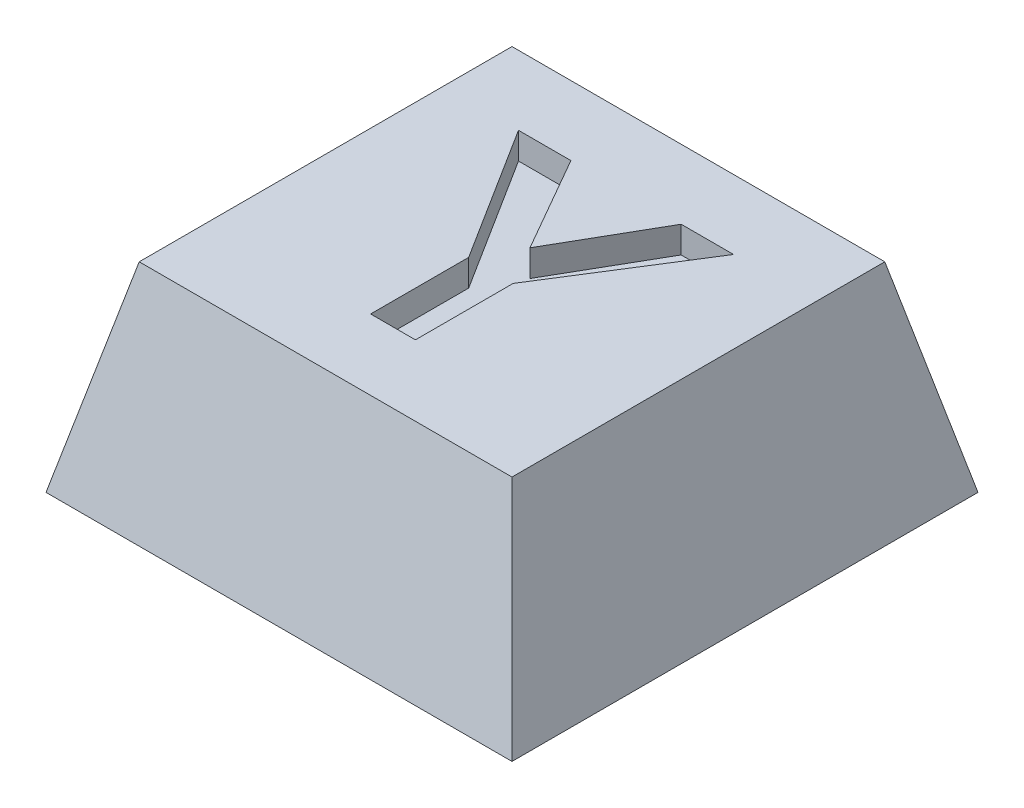
from build123d import *

# Parameters (mm, degrees)
SKETCH1_W           = 7
SKETCH1_H           = 7
BOSS_EXTRUDE1_DEPTH = 3
CUT_EXTRUDE1_DEPTH  = 7
CUT_EXTRUDE2_DEPTH  = 11
SKETCH4_R           = 1.8
CUT_EXTRUDE3_DEPTH  = 0.8
CUT_EXTRUDE4_DEPTH  = 0.4


with BuildPart() as part:
    # Sketch1 → Boss-Extrude1 (new body)
    with BuildSketch(Plane(origin=(0, 0, 0), x_dir=(1, 0, 0), z_dir=(0, 1, 0))):
        with Locations((3.5, 3.5)):
            Rectangle(SKETCH1_W, SKETCH1_H)
    extrude(amount=BOSS_EXTRUDE1_DEPTH)

    # Sketch2 → Cut-Extrude1 (cut)
    with BuildSketch(Plane.XY):
        Polygon((0, 0), (0.7, 3), (0, 3), align=None)
        Polygon((7, 0), (6.3, 3), (7, 3), align=None)
    extrude(amount=-CUT_EXTRUDE1_DEPTH, mode=Mode.SUBTRACT)

    # Sketch3 → Cut-Extrude2 (cut)
    with BuildSketch(Plane(origin=(0, 0, 0), x_dir=(0, 0, -1), z_dir=(1, 0, 0))):
        Polygon((0, 0), (0.7, 3), (0, 3), align=None)
        Polygon((7, 3), (6.3, 3), (7, 0), align=None)
    extrude(amount=CUT_EXTRUDE2_DEPTH, mode=Mode.SUBTRACT)

    # Sketch4 → Cut-Extrude3 (cut)
    with BuildSketch(Plane.XZ):
        with Locations(Location((3.5, -3.5, 0), (0, 0, 270))):
            Circle(SKETCH4_R)
    extrude(amount=-CUT_EXTRUDE3_DEPTH, mode=Mode.SUBTRACT)

    # Sketch5 → Cut-Extrude4 (cut)
    with BuildSketch(Plane(origin=(0, 3, 0), x_dir=(1, 0, 0), z_dir=(0, 1, 0))):
        Polygon((3.116897122, 1.759282352), (3.116897122, 3.232339243), (1.838050969, 5.259282352), (2.625410744, 5.259282352), (3.452734462, 3.81707482), (4.281460424, 5.259282352), (5.068820199, 5.259282352), (3.789974045, 3.22743139), (3.789974045, 1.759282352), align=None)
    extrude(amount=-CUT_EXTRUDE4_DEPTH, mode=Mode.SUBTRACT)


solid = part.part
